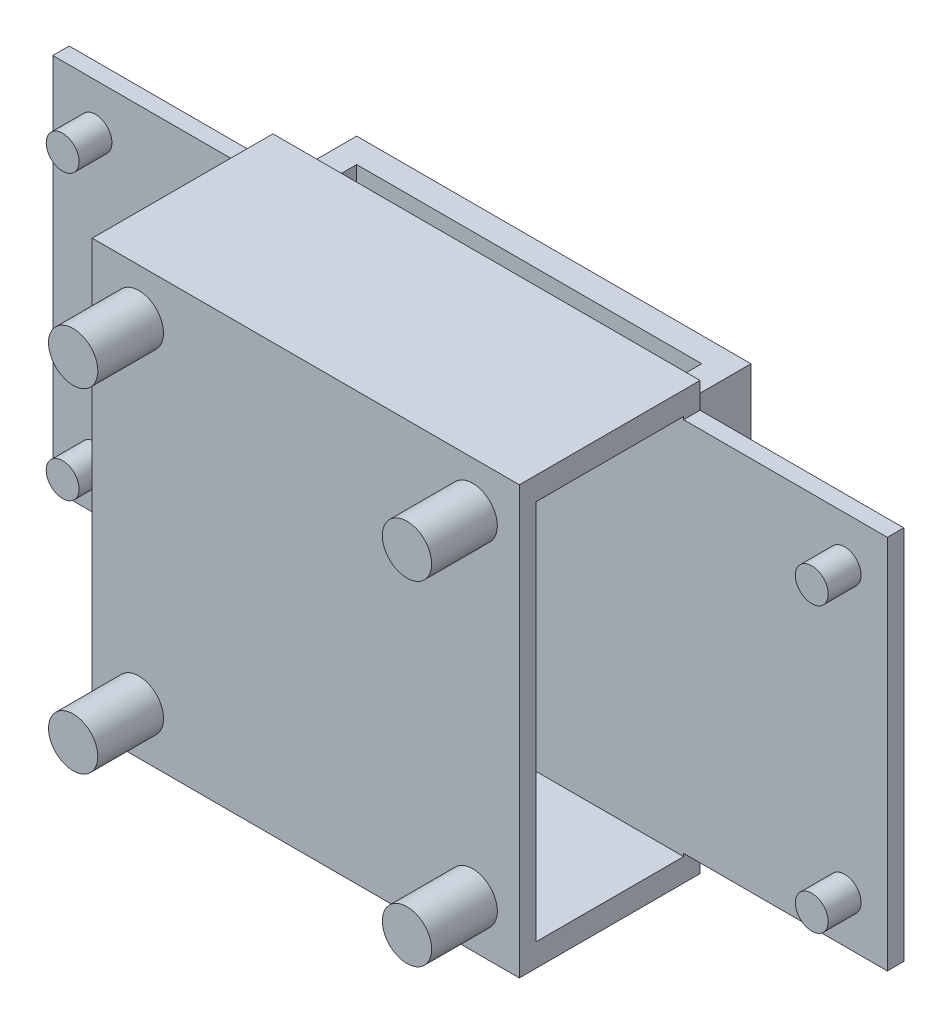
from build123d import *

# Parameters (mm, degrees)
EXTRUDE_1_DEPTH     = 1
SKETCH_3_R          = 1
EXTRUDE_2_DEPTH     = 2
SKETCH_9_W          = 26
SKETCH_9_H          = 1.4
EXTRUDE_4_DEPTH     = 9
SKETCH_10_W         = 26
SKETCH_10_H         = 26
EXTRUDE_5_DEPTH     = 1
SKETCH_11_R         = 1.5
EXTRUDE_6_DEPTH     = 4
SKETCH_6_W          = 24
SKETCH_6_H          = 4
EXTRUDE_7_DEPTH     = 4
SKETCH_12_W         = 21
SKETCH_12_H         = 2
CUT_EXTRUDE_3_DEPTH = 25


with BuildPart() as part:
    # 草图1 → 凸台-拉伸1 (new body)
    with BuildSketch(Plane.XY):
        Polygon((-13, -11.43), (-13, -13), (13, -13), (13, -11.43), (25.4, -11.43), (25.4, 11.43), (13, 11.43), (13, 13), (-13, 13), (-13, 11.43), (-25.4, 11.43), (-25.4, -11.43), align=None)
    extrude(amount=EXTRUDE_1_DEPTH)

    # 草图3 → 凸台-拉伸2 (add)
    with BuildSketch(Plane.XY.offset(1)):
        with Locations(Location((-22.8, -8.63, 0), (0, 0, 180))):
            Circle(SKETCH_3_R)
        with Locations(Location((-22.8, 8.63, 0), (0, 0, 180))):
            Circle(SKETCH_3_R)
        with Locations(Location((22.8, -8.63, 0), (0, 0, 180))):
            Circle(SKETCH_3_R)
        with Locations(Location((22.8, 8.63, 0), (0, 0, 180))):
            Circle(SKETCH_3_R)
    extrude(amount=EXTRUDE_2_DEPTH)

    # 草图9 → 凸台-拉伸4 (add)
    with BuildSketch(Plane.XY.offset(1)):
        with Locations((0, 12.3)):
            Rectangle(SKETCH_9_W, SKETCH_9_H)
        with Locations((0, -12.3)):
            Rectangle(SKETCH_9_W, SKETCH_9_H)
    extrude(amount=EXTRUDE_4_DEPTH)

    # 草图10 → 凸台-拉伸5 (add)
    with BuildSketch(Plane.XY.offset(10)):
        Rectangle(SKETCH_10_W, SKETCH_10_H)
    extrude(amount=EXTRUDE_5_DEPTH)

    # 草图11 → 凸台-拉伸6 (add)
    with BuildSketch(Plane.XY.offset(11)):
        with Locations((-10.16, -10.16)):
            Circle(SKETCH_11_R)
        with Locations(Location((10.16, -10.16, 0), (0, 0, 180))):
            Circle(SKETCH_11_R)
        with Locations((10.16, 10.16)):
            Circle(SKETCH_11_R)
        with Locations(Location((-10.16, 10.16, 0), (0, 0, 180))):
            Circle(SKETCH_11_R)
    extrude(amount=EXTRUDE_6_DEPTH)

    # 草图6 → 凸台-拉伸7 (add)
    with BuildSketch(Plane(origin=(0, 0, 0), x_dir=(-1, 0, 0), z_dir=(0, 0, -1))):
        with Locations((-0.1, 9.43)):
            Rectangle(SKETCH_6_W, SKETCH_6_H)
        with Locations((-0.1, -9.43)):
            Rectangle(SKETCH_6_W, SKETCH_6_H)
    extrude(amount=EXTRUDE_7_DEPTH)

    # 草图12 → 切除-拉伸3 (cut)
    with BuildSketch(Plane(origin=(0, -11.43, 0), x_dir=(-1, 0, 0), z_dir=(0, -1, 0))):
        with Locations((-0.1, 1.5)):
            Rectangle(SKETCH_12_W, SKETCH_12_H)
    extrude(amount=-CUT_EXTRUDE_3_DEPTH, mode=Mode.SUBTRACT)


solid = part.part
